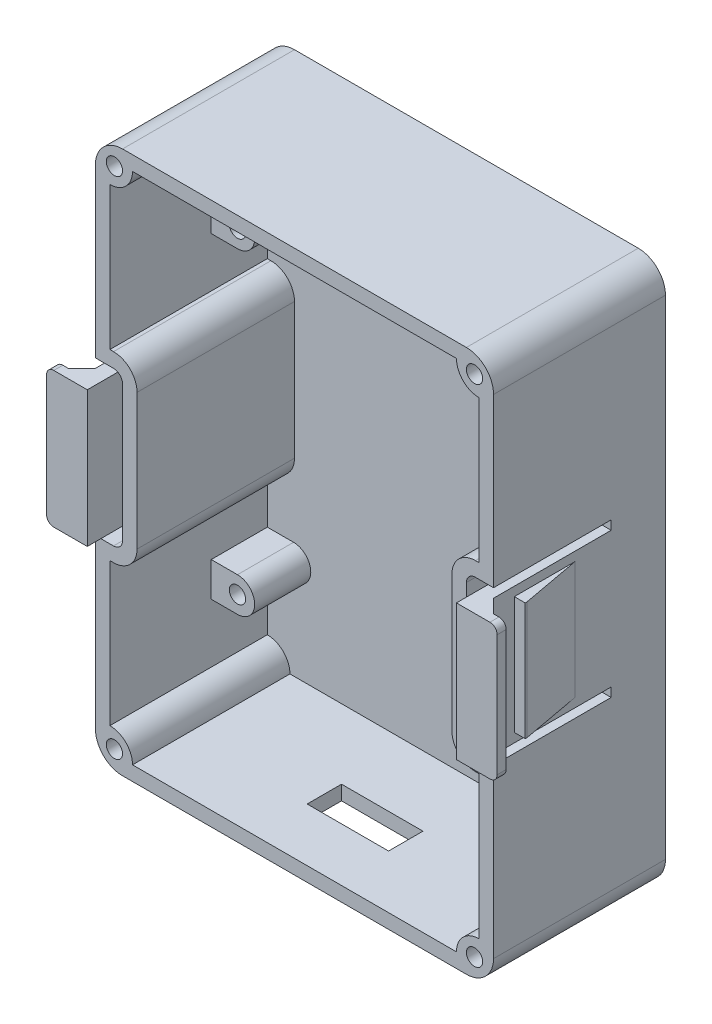
from build123d import *

# Parameters (mm, degrees)
SKETCH_1_W               = 44
SKETCH_1_H               = 60
EXTRUDE_1_DEPTH          = 19
SKETCH_2_W               = 3
SKETCH_2_H               = 17
CUT_EXTRUDE_1_DEPTH      = 42.773197148
FILLET_1_R               = 3
FILLET_2_R               = 1
SHELL_1_T                = -1.6
EXTRUDE_2_DEPTH          = 17.4
SKETCH_3_3_R             = 0.9
CUT_EXTRUDE_2_DEPTH      = 17.4
MIRROR_2_COPY_1_DEPTH    = 17.4
MIRROR_2_COPY_2_SKETCH_R = 0.9
MIRROR_2_COPY_2_DEPTH    = 17.4
SKETCH_4_W               = 5
SKETCH_4_H               = 15
EXTRUDE_3_DEPTH          = 6.2
CUT_EXTRUDE_3_DEPTH      = 42.070183832
CUT_EXTRUDE_3_DEPTH_BACK = 42.070183832
SKETCH_4_4_W             = 1.8
SKETCH_4_4_H             = 1.7
SKETCH_5_R               = 0.9
EXTRUDE_4_DEPTH          = 6.2
SKETCH_6_W               = 9
SKETCH_6_H               = 3.8
CUT_EXTRUDE_4_DEPTH      = 66.234653368
SKETCH_8_W               = 3
SKETCH_8_H               = 17
EXTRUDE_5_DEPTH          = 6
SKETCH_9_W               = 1.6
SKETCH_9_H               = 15
EXTRUDE_6_DEPTH          = 15.5
EXTRUDE_7_DEPTH          = 15
EXTRUDE_8_DEPTH          = 6.5
FILLET_3_R               = 0.8
FILLET_3_OF_MIRROR_3_R   = 0.8


with BuildPart() as part:
    # 草图1 → 凸台-拉伸1 (new body)
    with BuildSketch(Plane.XY):
        Rectangle(SKETCH_1_W, SKETCH_1_H)
    extrude(amount=EXTRUDE_1_DEPTH)

    # 草图2 → 切除-拉伸1 (cut, through all)
    with BuildSketch(Plane.XY.offset(19)):
        with Locations((-20.5, 0)):
            Rectangle(SKETCH_2_W, SKETCH_2_H)
        with Locations((20.5, 0)):
            Rectangle(SKETCH_2_W, SKETCH_2_H)
    extrude(amount=-CUT_EXTRUDE_1_DEPTH, mode=Mode.SUBTRACT)

    # 圆角1
    fillet_1_edges = [part.edges().sort_by_distance(p)[0] for p in [
        (22, -30, 9.5),
        (-22, -30, 9.5),
        (-22, 30, 9.5),
        (22, 30, 9.5),
    ]]
    fillet(fillet_1_edges, radius=FILLET_1_R)

    # 圆角2
    fillet_2_edges = [part.edges().sort_by_distance(p)[0] for p in [
        (-19, 8.5, 9.5),
        (-19, -8.5, 9.5),
        (19, -8.5, 9.5),
        (19, 8.5, 9.5),
    ]]
    fillet(fillet_2_edges, radius=FILLET_2_R)

    # 抽壳1
    shell_1_openings = [part.faces().sort_by_distance(p)[0] for p in [
        (0, 0, 19),
    ]]
    offset(amount=SHELL_1_T, openings=shell_1_openings, kind=Kind.INTERSECTION)

    # 草图3 → 凸台-拉伸2 (add)
    with BuildSketch(Plane.XY.offset(1.6)):
        with BuildLine():
            Line((-20.4, 28.4), (-17.9, 28.4))
            ThreePointArc((-17.9, 28.4), (-18.632233047, 26.632233047), (-20.4, 25.9))
            Line((-20.4, 25.9), (-20.4, 28.4))
        make_face()
    extrude_2 = extrude(amount=EXTRUDE_2_DEPTH)

    # 草图3<3> → 切除-拉伸2 (cut)
    with BuildSketch(Plane.XY.offset(1.6)):
        with Locations(Location((-19.9, 27.9, 0), (0, 0, 180))):
            Circle(SKETCH_3_3_R)
    cut_extrude_2 = extrude(amount=CUT_EXTRUDE_2_DEPTH, mode=Mode.SUBTRACT)

    # 镜向1: 凸台-拉伸2, 切除-拉伸2 across plane
    add(extrude_2.mirror(Plane(origin=(0, 0, 0), x_dir=(0, 0, 1), z_dir=(1, 0, 0))))
    add(cut_extrude_2.mirror(Plane(origin=(0, 0, 0), x_dir=(0, 0, 1), z_dir=(1, 0, 0))), mode=Mode.SUBTRACT)

    # 镜向2: 凸台-拉伸2, 切除-拉伸2 across plane
    add(extrude_2.mirror(Plane.ZX))
    add(cut_extrude_2.mirror(Plane.ZX), mode=Mode.SUBTRACT)

    # 镜向2 copy 1 sketch → 镜向2 copy 1 (add)
    with BuildSketch(Plane(origin=(0, 0, 1.6), x_dir=(-1, 0, 0), z_dir=(0, 0, 1))):
        with BuildLine():
            Line((-20.4, 28.4), (-17.9, 28.4))
            ThreePointArc((-17.9, 28.4), (-18.632233047, 26.632233047), (-20.4, 25.9))
            Line((-20.4, 25.9), (-20.4, 28.4))
        make_face()
    extrude(amount=MIRROR_2_COPY_1_DEPTH)

    # 镜向2 copy 2 sketch → 镜向2 copy 2 (cut)
    with BuildSketch(Plane(origin=(0, 0, 1.6), x_dir=(-1, 0, 0), z_dir=(0, 0, 1))):
        with Locations(Location((-19.9, 27.9, 0), (0, 0, 180))):
            Circle(MIRROR_2_COPY_2_SKETCH_R)
    extrude(amount=MIRROR_2_COPY_2_DEPTH, mode=Mode.SUBTRACT)

    # 草图4 → 凸台-拉伸3 (add)
    with BuildSketch(Plane.XY.offset(1.6)):
        with Locations((16, -20.9)):
            Rectangle(SKETCH_4_W, SKETCH_4_H)
    extrude(amount=EXTRUDE_3_DEPTH)

    # 草图4<4> → 切除-拉伸3 (cut, two sides: drawn at the far end of the back side and taken through both)
    with BuildSketch(Plane.XY.offset(1.6).offset(-CUT_EXTRUDE_3_DEPTH_BACK)):
        with Locations((16, -26.15)):
            Rectangle(SKETCH_4_4_W, SKETCH_4_4_H)
        with Locations((16, -23.61)):
            Rectangle(SKETCH_4_4_W, SKETCH_4_4_H)
        with Locations((16, -21.07)):
            Rectangle(SKETCH_4_4_W, SKETCH_4_4_H)
        with Locations((16, -18.53)):
            Rectangle(SKETCH_4_4_W, SKETCH_4_4_H)
        with Locations((16, -15.99)):
            Rectangle(SKETCH_4_4_W, SKETCH_4_4_H)
    extrude(amount=CUT_EXTRUDE_3_DEPTH + CUT_EXTRUDE_3_DEPTH_BACK, mode=Mode.SUBTRACT)

    # 草图5 → 凸台-拉伸4 (add)
    # profile 1 of 3: a face of its own
    with BuildSketch(Plane.XY.offset(1.6)):
        with BuildLine():
            Line((-17.5, 19.4), (-20.4, 19.4))
            Line((-20.4, 19.4), (-20.4, 15.6))
            Line((-20.4, 15.6), (-17.5, 15.6))
            ThreePointArc((-17.5, 15.6), (-15.6, 17.5), (-17.5, 19.4))
        make_face()
        with Locations(Location((-17.5, 17.5, 0), (0, 0, 180))):
            Circle(SKETCH_5_R, mode=Mode.SUBTRACT)
    # profile 2 of 3: a face of its own
    with BuildSketch(Plane.XY.offset(1.6)):
        with BuildLine():
            Line((20.4, 15.6), (17.5, 15.6))
            ThreePointArc((17.5, 15.6), (15.6, 17.5), (17.5, 19.4))
            Line((17.5, 19.4), (20.4, 19.4))
            Line((20.4, 19.4), (20.4, 15.6))
        make_face()
        with Locations(Location((17.5, 17.5, 0), (0, 0, 180))):
            Circle(SKETCH_5_R, mode=Mode.SUBTRACT)
    # profile 3 of 3: a face of its own
    with BuildSketch(Plane.XY.offset(1.6)):
        with BuildLine():
            Line((-20.4, -15.6), (-17.5, -15.6))
            ThreePointArc((-17.5, -15.6), (-15.6, -17.5), (-17.5, -19.4))
            Line((-17.5, -19.4), (-20.4, -19.4))
            Line((-20.4, -19.4), (-20.4, -15.6))
        make_face()
        with Locations(Location((-17.5, -17.5, 0), (0, 0, 180))):
            Circle(SKETCH_5_R, mode=Mode.SUBTRACT)
    extrude(amount=EXTRUDE_4_DEPTH)

    # 草图6 → 切除-拉伸4 (cut, through all)
    with BuildSketch(Plane(origin=(0, -28.4, 0), x_dir=(1, 0, 0), z_dir=(0, 1, 0))):
        with Locations((0, -11.2)):
            Rectangle(SKETCH_6_W, SKETCH_6_H)
    extrude(amount=-CUT_EXTRUDE_4_DEPTH, mode=Mode.SUBTRACT)

    # 草图8 → 凸台-拉伸5 (add)
    with BuildSketch(Plane(origin=(0, 0, 0), x_dir=(-1, 0, 0), z_dir=(0, 0, -1))):
        with Locations((-20.5, 0)):
            Rectangle(SKETCH_8_W, SKETCH_8_H)
    extrude_5 = extrude(amount=-EXTRUDE_5_DEPTH)

    # 草图9 → 凸台-拉伸6 (add)
    with BuildSketch(Plane.XY.offset(6)):
        with Locations((21.2, 0)):
            Rectangle(SKETCH_9_W, SKETCH_9_H)
    extrude_6 = extrude(amount=EXTRUDE_6_DEPTH)

    # 草图10 → 凸台-拉伸7 (add)
    with BuildSketch(Plane.XZ.offset(7.5)):
        Polygon((22, 21.5), (24.9, 21.5), (24.9, 20.5), (23.5, 20.5), (22, 19), align=None)
    extrude_7 = extrude(amount=-EXTRUDE_7_DEPTH)

    # 草图11 → 凸台-拉伸8 (add, symmetric)
    with BuildSketch(Plane(origin=(0, 0, 0), x_dir=(1, 0, 0), z_dir=(0, 1, 0))):
        Polygon((23.2, -16.5), (22, -10), (22, -16.7), (23.2, -16.7), align=None)
    extrude_8 = extrude(amount=EXTRUDE_8_DEPTH, both=True)

    # 圆角3
    fillet_3_edges = [part.edges().sort_by_distance(p)[0] for p in [
        (24.9, -7.5, 21),
        (24.9, 7.5, 21),
    ]]
    fillet(fillet_3_edges, radius=FILLET_3_R)

    # 镜向3: 凸台-拉伸5, 凸台-拉伸6, 凸台-拉伸7, 凸台-拉伸8 across plane
    add(extrude_5.mirror(Plane(origin=(0, 0, 0), x_dir=(0, 0, 1), z_dir=(1, 0, 0))))
    add(extrude_6.mirror(Plane(origin=(0, 0, 0), x_dir=(0, 0, 1), z_dir=(1, 0, 0))))
    add(extrude_7.mirror(Plane(origin=(0, 0, 0), x_dir=(0, 0, 1), z_dir=(1, 0, 0))))
    add(extrude_8.mirror(Plane(origin=(0, 0, 0), x_dir=(0, 0, 1), z_dir=(1, 0, 0))))

    # 圆角3 of 镜向3
    fillet_3_of_mirror_3_edges = [part.edges().sort_by_distance(p)[0] for p in [
        (-24.9, -7.5, 21),
        (-24.9, 7.5, 21),
    ]]
    fillet(fillet_3_of_mirror_3_edges, radius=FILLET_3_OF_MIRROR_3_R)


solid = part.part
